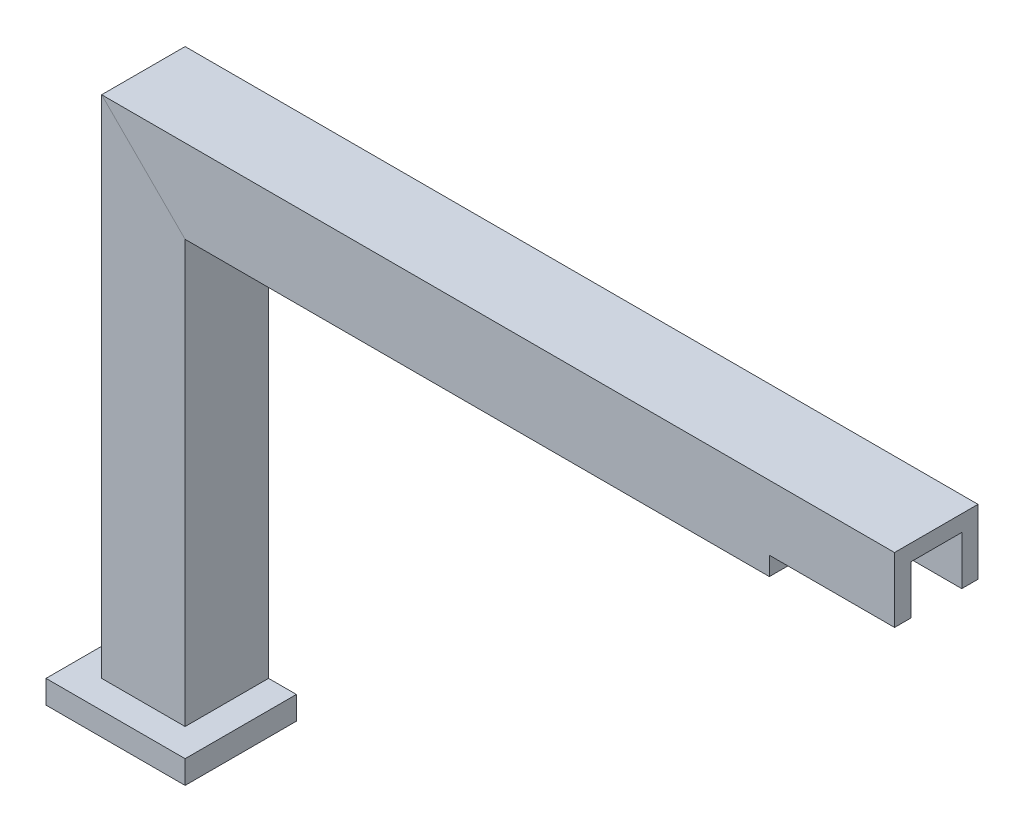
from build123d import *

# Parameters (mm, degrees)
SKETCH2_W           = 18
SKETCH2_H           = 18
SKETCH2_W_2         = 11
SKETCH2_H_2         = 11
SKETCH3_W           = 30
SKETCH3_H           = 30
SKETCH3_W_2         = 33.981635874
SKETCH3_H_2         = 34.73651567
BOSS_EXTRUDE1_DEPTH = 5
SKETCH4_W           = 50
SKETCH4_H           = 18
CUT_EXTRUDE1_DEPTH  = 4
SKETCH5_W           = 61.801380332
SKETCH5_H           = 123.620772257
CUT_EXTRUDE2_DEPTH  = 175
SKETCH6_W           = 30
SKETCH6_H           = 6
CUT_EXTRUDE3_DEPTH  = 10


with BuildPart() as part:
    # Sweep2: sweep along a path in Sketch1
    with BuildLine(Plane.XY) as sweep2_path:
        Line((0, 0), (0, 100))
        Line((0, 100), (320, 100))
        Line((320, 100), (320, 0))
    # Sketch2 → Sweep2 (sweep)
    with BuildSketch(Plane(origin=(0, 0, 0), x_dir=(1, 0, 0), z_dir=(0, 1, 0))):
        Rectangle(SKETCH2_W, SKETCH2_H)
        Rectangle(SKETCH2_W_2, SKETCH2_H_2, mode=Mode.SUBTRACT)
    sweep(path=sweep2_path.line, transition=Transition.RIGHT)

    # Sketch3 → Boss-Extrude1 (add)
    with BuildSketch(Plane(origin=(0, 0, 0), x_dir=(1, 0, 0), z_dir=(0, 1, 0))):
        Rectangle(SKETCH3_W, SKETCH3_H)
        with Locations((320, 0)):
            Rectangle(SKETCH3_W_2, SKETCH3_H_2)
    extrude(amount=-BOSS_EXTRUDE1_DEPTH)

    # Sketch4 → Cut-Extrude1 (cut)
    with BuildSketch(Plane.XZ.offset(-91)):
        with Locations((160, 0)):
            Rectangle(SKETCH4_W, SKETCH4_H)
    extrude(amount=-CUT_EXTRUDE1_DEPTH, mode=Mode.SUBTRACT)

    # Sketch5 → Cut-Extrude2 (cut)
    with BuildSketch(Plane(origin=(336.990817937, 0, 0), x_dir=(0, 0, -1), z_dir=(1, 0, 0))):
        with Locations((13.532432331, 56.810386129)):
            Rectangle(SKETCH5_W, SKETCH5_H)
    extrude(amount=-CUT_EXTRUDE2_DEPTH, mode=Mode.SUBTRACT)

    # Sketch6 → Cut-Extrude3 (cut)
    with BuildSketch(Plane(origin=(0, 0, 0), x_dir=(1, 0, 0), z_dir=(0, 1, 0))):
        with Locations((0, 12)):
            Rectangle(SKETCH6_W, SKETCH6_H)
    extrude(amount=-CUT_EXTRUDE3_DEPTH, mode=Mode.SUBTRACT)


solid = part.part
